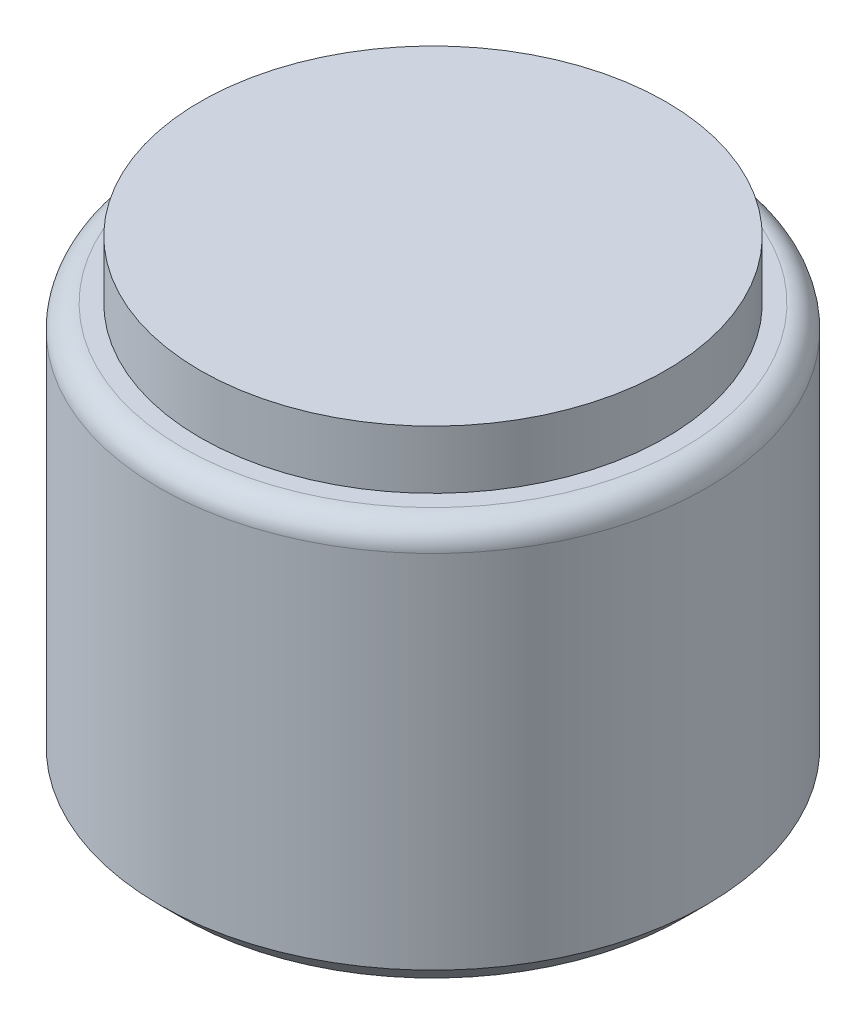
from build123d import *

# Parameters (mm, degrees)
HOLE_WIZARD_M16_1_D     = 14
HOLE_WIZARD_M16_1_DEPTH = 38
HOLE_WIZARD_M16_1_TIP   = 4.206024333
CHAMFER_1_SIZE          = 10
FILLET_1_R              = 10


with BuildPart() as part:
    # 草图1 → 旋转1 (revolve)
    with BuildSketch(Plane.XY, mode=Mode.PRIVATE) as revolve_1_sk:
        Polygon((0, 0), (100, 0), (100, -25), (117.5, -25), (117.5, -200), (67.5, -200), (67.5, -165), (0, -165), align=None)
    revolve(revolve_1_sk.sketch.rotate(Axis((0, 0, 0), (0, 1, 0)), 90), axis=Axis((0, 0, 0), (0, 1, 0)))

    # M16 螺纹孔1
    with Locations(Plane(origin=(0, -165, 0), x_dir=(-1, 0, 0), z_dir=(0, -1, 0))):
        with Locations((0, 0)):
            Hole(HOLE_WIZARD_M16_1_D / 2, depth=HOLE_WIZARD_M16_1_DEPTH)
            with Locations((0, 0, -(HOLE_WIZARD_M16_1_DEPTH + HOLE_WIZARD_M16_1_TIP / 2))):  # 118° drill point
                Cone(0, HOLE_WIZARD_M16_1_D / 2, HOLE_WIZARD_M16_1_TIP, mode=Mode.SUBTRACT)

    # 倒角1
    chamfer_1_edges = [part.edges().sort_by_distance(p)[0] for p in [
        (0, -200, 117.5),
    ]]
    chamfer(chamfer_1_edges, length=CHAMFER_1_SIZE)

    # 圆角1
    fillet_1_edges = [part.edges().sort_by_distance(p)[0] for p in [
        (0, -25, 117.5),
    ]]
    fillet(fillet_1_edges, radius=FILLET_1_R)


solid = part.part
